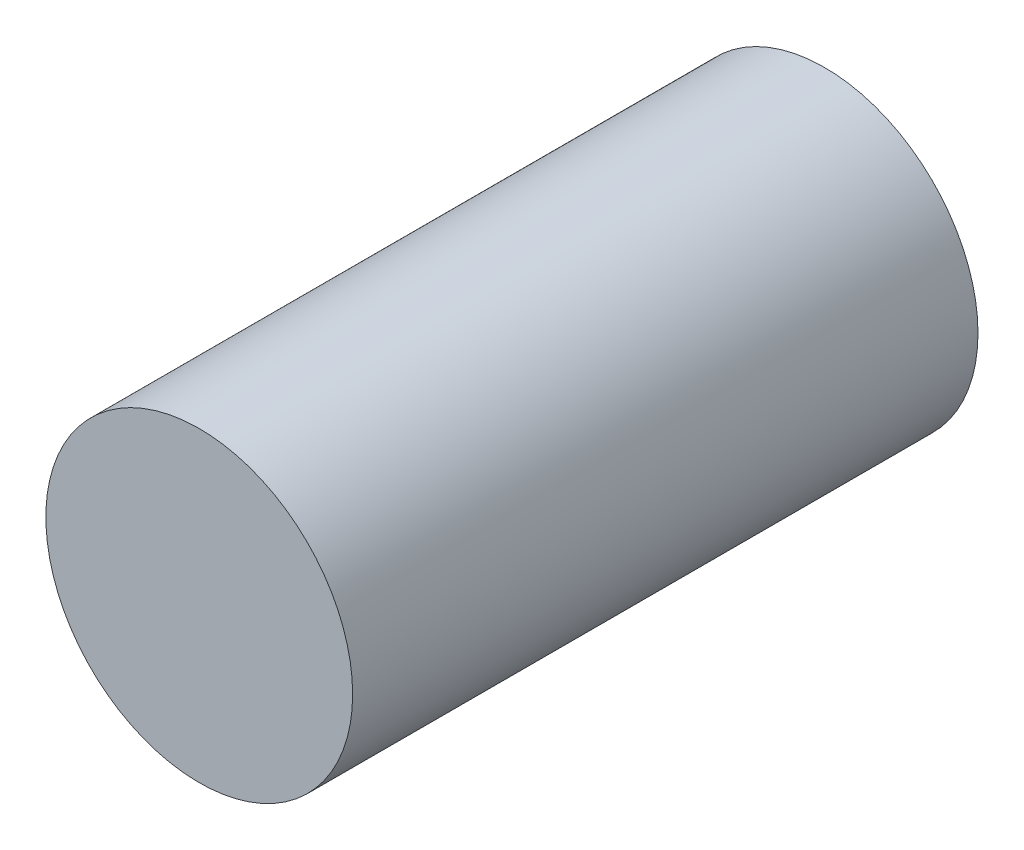
from build123d import *

# Parameters (mm, degrees)
ESQUISSE1_R      = 6.5
EXTRUSION1_DEPTH = 26.5


with BuildPart() as part:
    # Esquisse1 → Extrusion1 (new body)
    with BuildSketch(Plane.XY):
        Circle(ESQUISSE1_R)
    extrude(amount=EXTRUSION1_DEPTH)


solid = part.part
